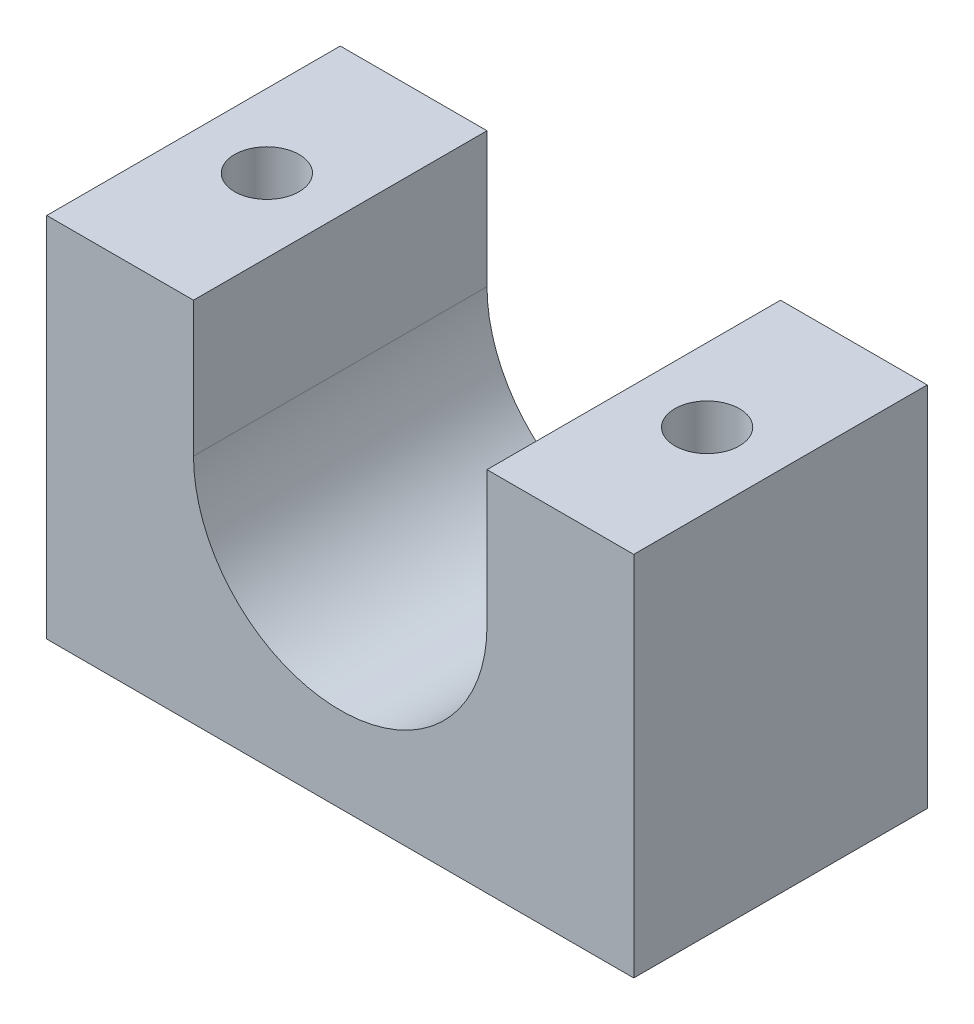
from build123d import *

# Parameters (mm, degrees)
SKETCH1_W           = 40
SKETCH1_H           = 25
BOSS_EXTRUDE1_DEPTH = 20
CUT_EXTRUDE1_DEPTH  = 33.398148095
HOLE1_D             = 4.4
HOLE2_D             = 4.4


with BuildPart() as part:
    # Sketch1 → Boss-Extrude1 (new body)
    with BuildSketch(Plane.XY.offset(20)):
        with Locations((0, -3.3)):
            Rectangle(SKETCH1_W, SKETCH1_H)
    extrude(amount=-BOSS_EXTRUDE1_DEPTH)

    # Sketch2 → Cut-Extrude1 (cut, through all)
    with BuildSketch(Plane(origin=(0, 0, 0), x_dir=(-1, 0, 0), z_dir=(0, 0, -1))):
        with BuildLine():
            Line((10, 9.2), (-10, 9.2))
            Line((-10, 9.2), (-10, 0))
            ThreePointArc((-10, 0), (0, -10), (10, 0))
            Line((10, 0), (10, 9.2))
        make_face()
    extrude(amount=-CUT_EXTRUDE1_DEPTH, mode=Mode.SUBTRACT)

    # Hole1 (through all)
    with Locations(Plane(origin=(0, 9.2, 0), x_dir=(-1, 0, 0), z_dir=(0, 1, 0))):
        with Locations((15, 10)):
            Hole(HOLE1_D / 2)

    # Hole2 (through all)
    with Locations(Plane(origin=(0, 9.2, 0), x_dir=(-1, 0, 0), z_dir=(0, 1, 0))):
        with Locations((-15, 10)):
            Hole(HOLE2_D / 2)


solid = part.part
